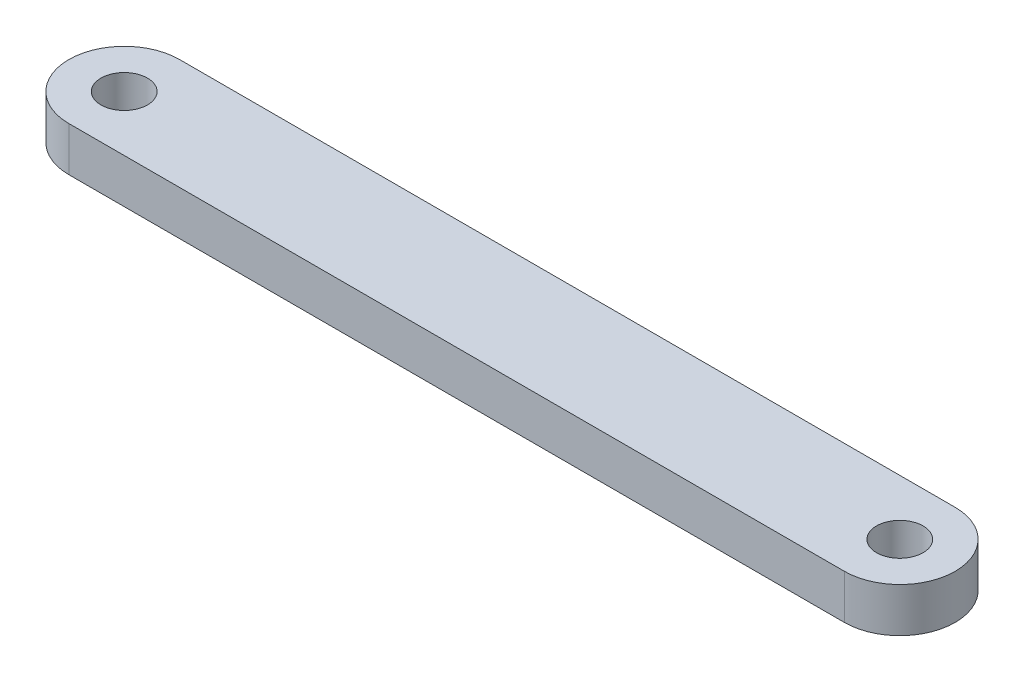
from build123d import *

# Parameters (mm, degrees)
SKETCH1_R           = 1.05
BOSS_EXTRUDE1_DEPTH = 2


with BuildPart() as part:
    # Sketch1 → Boss-Extrude1 (new body)
    with BuildSketch(Plane(origin=(0, 0, 0), x_dir=(1, 0, 0), z_dir=(0, 1, 0))):
        with BuildLine():
            Line((0, 2.5), (35, 2.5))
            ThreePointArc((35, 2.5), (37.5, 0), (35, -2.5))
            Line((35, -2.5), (0, -2.5))
            ThreePointArc((0, -2.5), (-2.5, 0), (0, 2.5))
        make_face()
        with Locations(Location((0, 0, 0), (0, 0, 270))):
            Circle(SKETCH1_R, mode=Mode.SUBTRACT)
        with Locations(Location((35, 0, 0), (0, 0, 270))):
            Circle(SKETCH1_R, mode=Mode.SUBTRACT)
    extrude(amount=BOSS_EXTRUDE1_DEPTH)


solid = part.part
